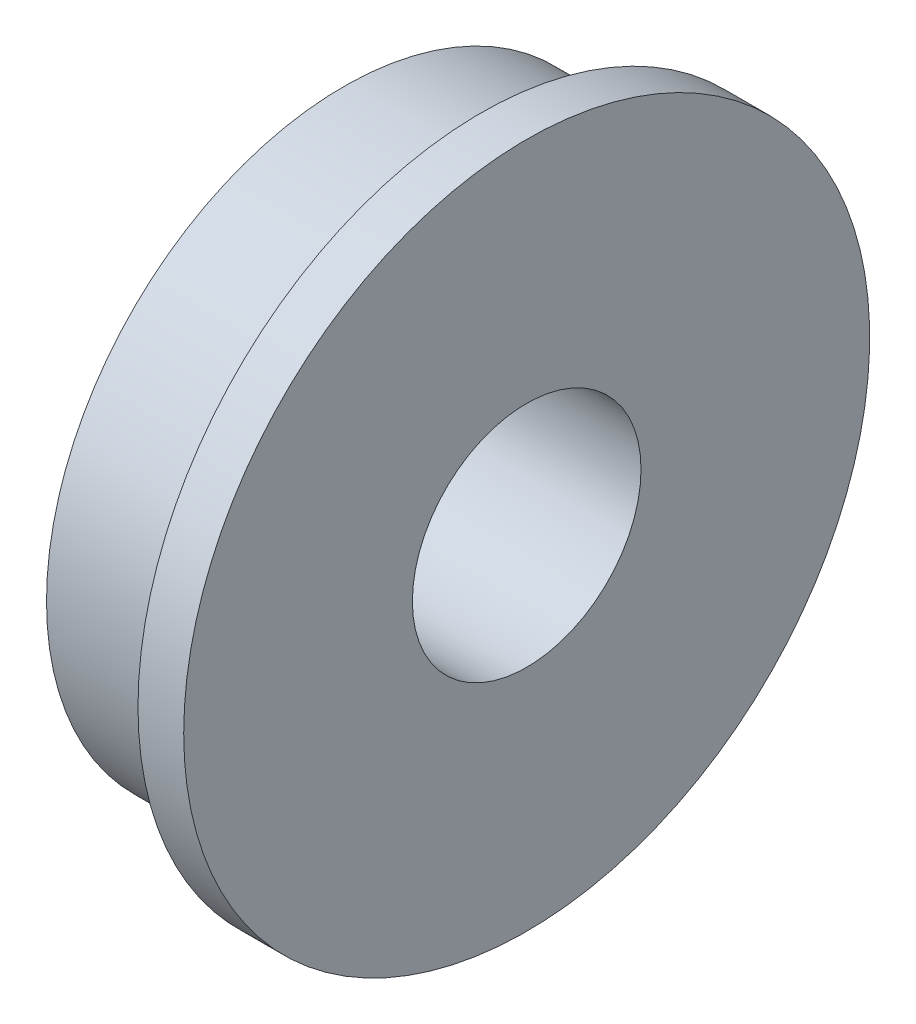
from build123d import *


with BuildPart() as part:
    # 草图1 → 旋转1 (revolve)
    with BuildSketch(Plane(origin=(0, 0, 0), x_dir=(1, 0, 0), z_dir=(0, 1, 0)), mode=Mode.PRIVATE) as revolve_1_sk:
        Polygon((4, 2.5), (4, 7.5), (3, 7.5), (3, 6.5), (0, 6.5), (0, 2.5), align=None)
    revolve(revolve_1_sk.sketch.rotate(Axis((0, 0, 0), (1, 0, 0)), 180), axis=Axis((0, 0, 0), (1, 0, 0)))


solid = part.part
